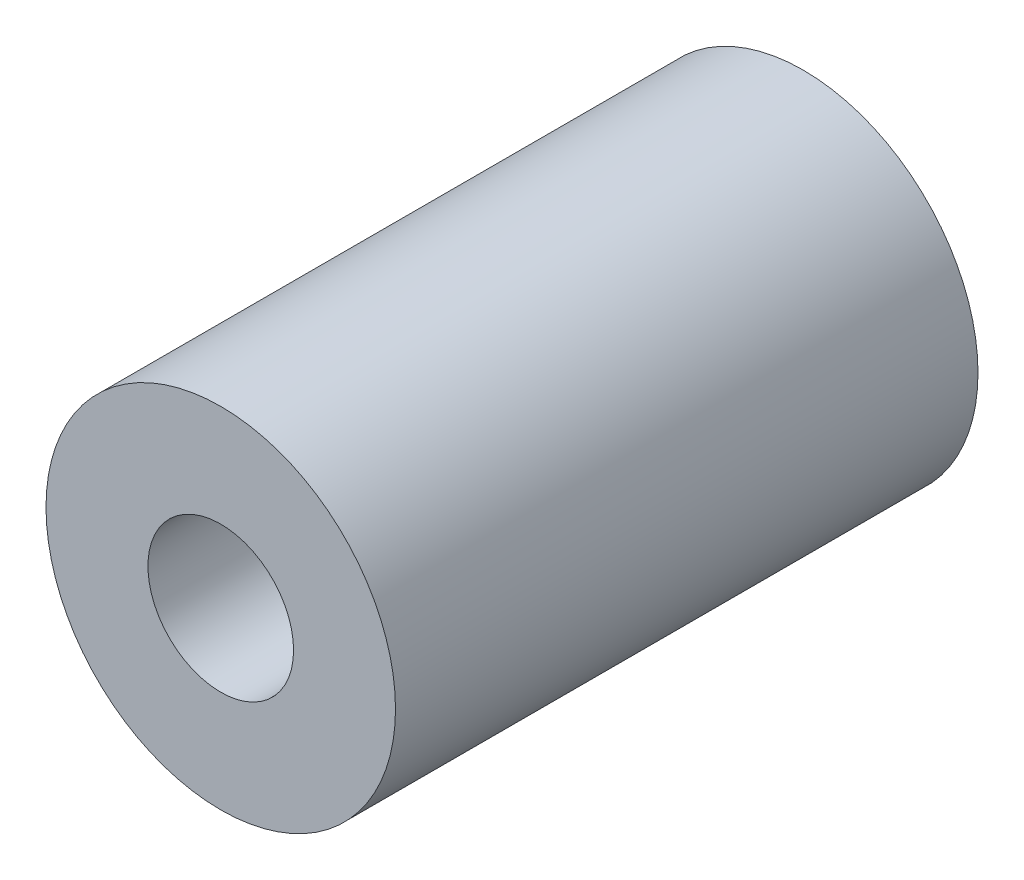
from build123d import *

# Parameters (mm, degrees)
CROQUIS1_R              = 6
CROQUIS1_R_2            = 2.5
SALIENTE_EXTRUIR1_DEPTH = 20
CROQUIS3_R              = 0.867381205
CROQUIS3_R_2            = 0.727192855
CORTAR_EXTRUIR1_DEPTH   = 22.725560982


with BuildPart() as part:
    # Croquis1 → Saliente-Extruir1 (new body)
    with BuildSketch(Plane.XY):
        Circle(CROQUIS1_R)
        Circle(CROQUIS1_R_2, mode=Mode.SUBTRACT)
    extrude(amount=SALIENTE_EXTRUIR1_DEPTH)

    # Croquis3 → Cortar-Extruir1 (cut, through all)
    with BuildSketch(Plane(origin=(0, 0, 0), x_dir=(1, 0, 0), z_dir=(0, 1, 0))):
        with Locations(Location((0, -4.122765545, 0), (0, 0, 270))):
            Circle(CROQUIS3_R)
        with Locations(Location((0, -15.58966335, 0), (0, 0, 270))):
            Circle(CROQUIS3_R_2)
    extrude(amount=-CORTAR_EXTRUIR1_DEPTH, mode=Mode.SUBTRACT)


solid = part.part
